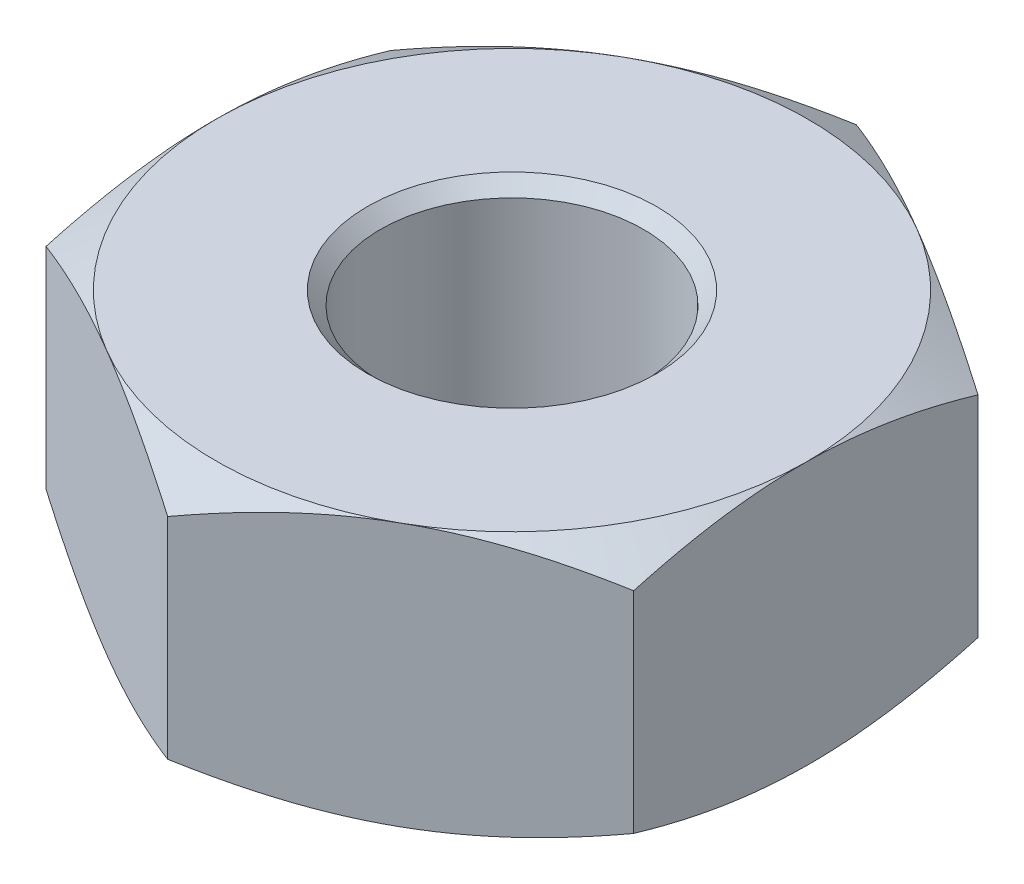
from build123d import *

# Parameters (mm, degrees)
SKETCH1_R           = 1
BOSS_EXTRUDE1_DEPTH = 2
SKETCH2_OUTSIDE_W   = 14.882
SKETCH2_OUTSIDE_H   = 15.558
SKETCH2_OUTSIDE_R   = 2.25
CUT_EXTRUDE1_DEPTH  = 2
CUT_EXTRUDE1_DRAFT  = 60
SKETCH3_OUTSIDE_W   = 14.882
SKETCH3_OUTSIDE_H   = 15.558
SKETCH3_OUTSIDE_R   = 2.25
CUT_EXTRUDE3_DEPTH  = 2
CUT_EXTRUDE3_DRAFT  = -60
CHAMFER1_SIZE       = 0.1


with BuildPart() as part:
    # Sketch1 → Boss-Extrude1 (new body)
    with BuildSketch(Plane(origin=(0, 0, 0), x_dir=(1, 0, 0), z_dir=(0, 1, 0))):
        Polygon((2.24033649, -1.315633845), (2.259540576, 1.282371391), (0.019204087, 2.598005235), (-2.24033649, 1.315633845), (-2.259540576, -1.282371391), (-0.019204087, -2.598005235), align=None)
        with Locations(Location((0, 0, 0), (0, 0, 270))):
            Circle(SKETCH1_R, mode=Mode.SUBTRACT)
    extrude(amount=BOSS_EXTRUDE1_DEPTH)


with BuildPart() as cut_extrude1_tool:
    # Sketch2 outside → Cut-Extrude1 (with draft: the straight prism first)
    with BuildSketch(Plane(origin=(0, 0, 0), x_dir=(1, 0, 0), z_dir=(0, 1, 0))):
        Rectangle(SKETCH2_OUTSIDE_W, SKETCH2_OUTSIDE_H)
        Circle(SKETCH2_OUTSIDE_R, mode=Mode.SUBTRACT)
    extrude(amount=CUT_EXTRUDE1_DEPTH)
    # Cut-Extrude1: the draft: its side faces are tilted about the plane it starts from
    cut_extrude1_sides = [cut_extrude1_tool.faces().sort_by_distance(p)[0] for p in [
        (0, 1, 7.779),
        (7.441, 1, 0),
        (0, 1, -7.779),
        (-7.441, 1, 0),
        (-2.25, 1, 0),
    ]]
    draft(cut_extrude1_sides, Plane(origin=(0, 0, 0), x_dir=(1, 0, 0), z_dir=(0, 1, 0)), CUT_EXTRUDE1_DRAFT)


with BuildPart() as part_1:
    add(part.part)

    # Cut-Extrude1: cut by cut_extrude1_tool
    add(cut_extrude1_tool.part, mode=Mode.SUBTRACT)


with BuildPart() as cut_extrude3_tool:
    # Sketch3 outside → Cut-Extrude3 (with draft: the straight prism first)
    with BuildSketch(Plane(origin=(0, 2, 0), x_dir=(1, 0, 0), z_dir=(0, 1, 0))):
        Rectangle(SKETCH3_OUTSIDE_W, SKETCH3_OUTSIDE_H)
        Circle(SKETCH3_OUTSIDE_R, mode=Mode.SUBTRACT)
    extrude(amount=-CUT_EXTRUDE3_DEPTH)
    # Cut-Extrude3: the draft: its side faces are tilted about the plane it starts from
    cut_extrude3_sides = [cut_extrude3_tool.faces().sort_by_distance(p)[0] for p in [
        (0, 1, 7.779),
        (7.441, 1, 0),
        (0, 1, -7.779),
        (-7.441, 1, 0),
        (-2.25, 1, 0),
    ]]
    draft(cut_extrude3_sides, Plane(origin=(0, 2, 0), x_dir=(1, 0, 0), z_dir=(0, 1, 0)), CUT_EXTRUDE3_DRAFT)


with BuildPart() as part_2:
    add(part_1.part)

    # Cut-Extrude3: cut by cut_extrude3_tool
    add(cut_extrude3_tool.part, mode=Mode.SUBTRACT)

    # Chamfer1
    chamfer1_edges = [part_2.edges().sort_by_distance(p)[0] for p in [
        (0, 2, -1),
    ]]
    chamfer(chamfer1_edges, length=CHAMFER1_SIZE)


solid = part_2.part
